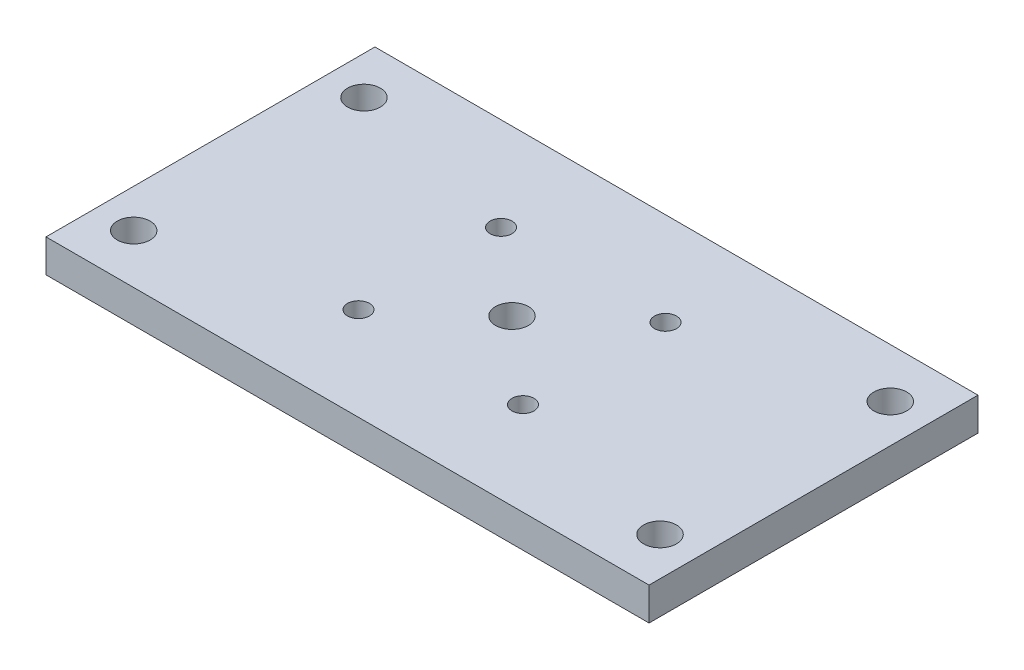
from build123d import *

# Parameters (mm, degrees)
ESQUISSE1_W        = 55
ESQUISSE1_H        = 30
ESQUISSE1_R        = 1
ESQUISSE1_R_2      = 1.5
BOSS_EXTRU_1_DEPTH = 3


with BuildPart() as part:
    # Esquisse1 → Boss.-Extru.1 (new body)
    with BuildSketch(Plane(origin=(0, 0, 0), x_dir=(1, 0, 0), z_dir=(0, 1, 0))):
        Rectangle(ESQUISSE1_W, ESQUISSE1_H)
        with Locations(Location((-7.5, 6.5, 0), (0, 0, 270))):
            Circle(ESQUISSE1_R, mode=Mode.SUBTRACT)
        with Locations(Location((-24, 10.5, 0), (0, 0, 270))):
            Circle(ESQUISSE1_R_2, mode=Mode.SUBTRACT)
        with Locations(Location((24, 10.5, 0), (0, 0, 90))):
            Circle(ESQUISSE1_R_2, mode=Mode.SUBTRACT)
        with Locations(Location((7.5, 6.5, 0), (0, 0, 90))):
            Circle(ESQUISSE1_R, mode=Mode.SUBTRACT)
        with Locations(Location((7.5, -6.5, 0), (0, 0, 270))):
            Circle(ESQUISSE1_R, mode=Mode.SUBTRACT)
        with Locations(Location((24, -10.5, 0), (0, 0, 270))):
            Circle(ESQUISSE1_R_2, mode=Mode.SUBTRACT)
        with Locations(Location((-24, -10.5, 0), (0, 0, 90))):
            Circle(ESQUISSE1_R_2, mode=Mode.SUBTRACT)
        with Locations(Location((-7.5, -6.5, 0), (0, 0, 90))):
            Circle(ESQUISSE1_R, mode=Mode.SUBTRACT)
        with Locations(Location((0, 0, 0), (0, 0, 270))):
            Circle(ESQUISSE1_R_2, mode=Mode.SUBTRACT)
    extrude(amount=BOSS_EXTRU_1_DEPTH)


solid = part.part
